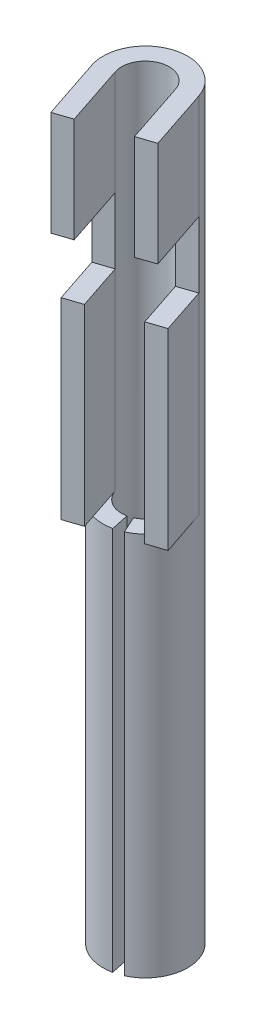
from build123d import *

# Parameters (mm, degrees)
EXTRUDE_THIN1_DEPTH = 6.35
EXTRUDE_THIN2_DEPTH = 3.175
EXTRUDE_THIN3_DEPTH = 1.0922
EXTRUDE_THIN4_DEPTH = 1.7272


with BuildPart() as part:
    # Sketch1 → Extrude-Thin1 (new body)
    with BuildSketch(Plane(origin=(0, 0, 0), x_dir=(1, 0, 0), z_dir=(0, 1, 0))):
        with BuildLine():
            ThreePointArc((0.288556611, -0.636111101), (-0.217707256, 0.66370611), (0.144278305, -0.683436918))
            Line((0.144278305, -0.683436918), (0.081320499, -0.385209899))
            ThreePointArc((0.081320499, -0.385209899), (-0.122707726, 0.374088898), (0.162640999, -0.358535348))
            Line((0.162640999, -0.358535348), (0.288556611, -0.636111101))
        make_face()
    extrude(amount=EXTRUDE_THIN1_DEPTH)

    # Sketch2 → Extrude-Thin2 (add)
    with BuildSketch(Plane(origin=(0, 6.35, 0), x_dir=(1, 0, 0), z_dir=(0, 1, 0))):
        with BuildLine():
            Line((0.916497603, -0.541281881), (0.662710919, 0.220718119))
            ThreePointArc((0.662710919, 0.220718119), (-0.220718119, 0.662710919), (-0.662710919, -0.220718119))
            Line((-0.662710919, -0.220718119), (-0.408924235, -0.982718119))
            Line((-0.408924235, -0.982718119), (-0.119741288, -0.886404758))
            Line((-0.119741288, -0.886404758), (-0.373527972, -0.124404758))
            ThreePointArc((-0.373527972, -0.124404758), (-0.124404758, 0.373527972), (0.373527972, 0.124404758))
            Line((0.373527972, 0.124404758), (0.627314657, -0.637595242))
            Line((0.627314657, -0.637595242), (0.916497603, -0.541281881))
        make_face()
    extrude(amount=EXTRUDE_THIN2_DEPTH)

    # Sketch3 → Extrude-Thin3 (add)
    with BuildSketch(Plane(origin=(0, 9.525, 0), x_dir=(1, 0, 0), z_dir=(0, 1, 0))):
        with BuildLine():
            ThreePointArc((0.662710919, 0.220718119), (-0.220718119, 0.662710919), (-0.662710919, -0.220718119))
            Line((-0.662710919, -0.220718119), (-0.373527972, -0.124404758))
            ThreePointArc((-0.373527972, -0.124404758), (-0.124404758, 0.373527972), (0.373527972, 0.124404758))
            Line((0.373527972, 0.124404758), (0.662710919, 0.220718119))
        make_face()
    extrude(amount=EXTRUDE_THIN3_DEPTH)

    # Sketch4 → Extrude-Thin4 (add)
    with BuildSketch(Plane(origin=(0, 10.6172, 0), x_dir=(1, 0, 0), z_dir=(0, 1, 0))):
        with BuildLine():
            Line((1.001093165, -0.795281881), (0.662710919, 0.220718119))
            ThreePointArc((0.662710919, 0.220718119), (-0.220718119, 0.662710919), (-0.662710919, -0.220718119))
            Line((-0.662710919, -0.220718119), (-0.324328673, -1.236718119))
            Line((-0.324328673, -1.236718119), (-0.035145727, -1.140404758))
            Line((-0.035145727, -1.140404758), (-0.373527972, -0.124404758))
            ThreePointArc((-0.373527972, -0.124404758), (-0.124404758, 0.373527972), (0.373527972, 0.124404758))
            Line((0.373527972, 0.124404758), (0.711910218, -0.891595242))
            Line((0.711910218, -0.891595242), (1.001093165, -0.795281881))
        make_face()
    extrude(amount=EXTRUDE_THIN4_DEPTH)


solid = part.part
